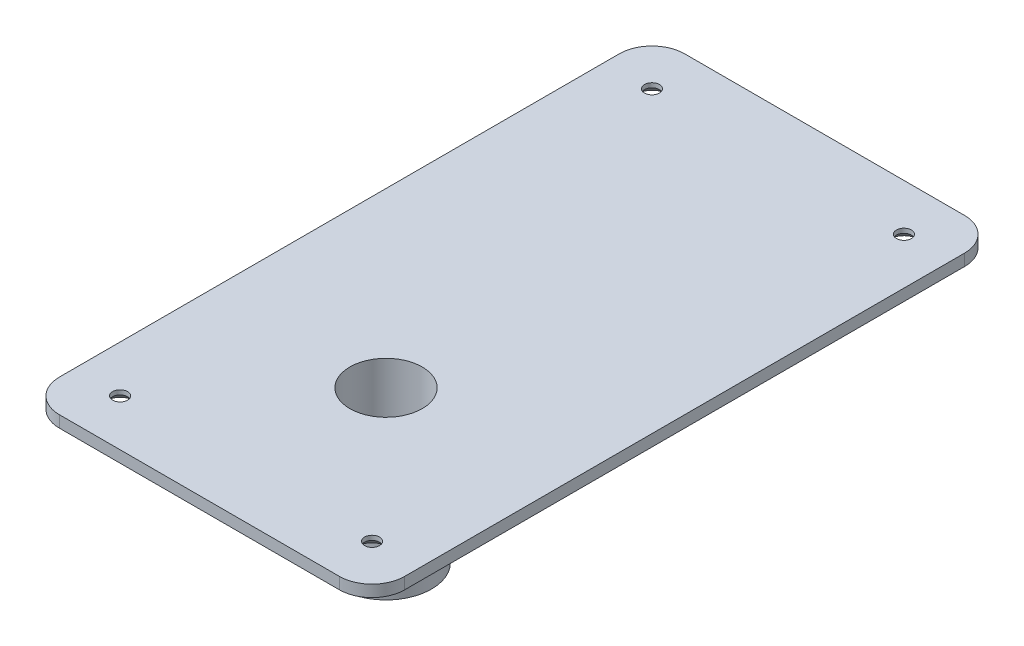
from build123d import *

# Parameters (mm, degrees)
BOSS_EXTRUDE1_DEPTH                                 = 2.5
SKETCH1_4_R                                         = 9.75
SKETCH1_4_R_2                                       = 7.75
BOSS_EXTRUDE3_DEPTH                                 = 30
CUT_EXTRUDE1_START                                  = 10
SKETCH1_5_R                                         = 7.75
CUT_EXTRUDE1_DEPTH                                  = 10
CSK_FOR_M3_COUNTERSUNK_FLAT_HEAD_SCREW1_D           = 3.2
CSK_FOR_M3_COUNTERSUNK_FLAT_HEAD_SCREW1_DEPTH       = 2.5
CSK_FOR_M3_COUNTERSUNK_FLAT_HEAD_SCREW1_CSINK_D     = 6.3
CSK_FOR_M3_COUNTERSUNK_FLAT_HEAD_SCREW1_CSINK_ANGLE = 90
CSK_FOR_M3_COUNTERSUNK_FLAT_HEAD_SCREW1_TIP         = 0.96137699


with BuildPart() as part:
    # Sketch1 → Boss-Extrude1 (new body)
    with BuildSketch(Plane(origin=(0, 0, 0), x_dir=(1, 0, 0), z_dir=(0, 1, 0))):
        with BuildLine():
            Line((-37, 60), (-37, -60))
            ThreePointArc((-37, -60), (-34.949747468, -64.949747468), (-30, -67))
            Line((-30, -67), (30, -67))
            ThreePointArc((30, -67), (34.949747468, -64.949747468), (37, -60))
            Line((37, -60), (37, 60))
            ThreePointArc((37, 60), (34.949747468, 64.949747468), (30, 67))
            Line((30, 67), (-30, 67))
            ThreePointArc((-30, 67), (-34.949747468, 64.949747468), (-37, 60))
        make_face()
    extrude(amount=BOSS_EXTRUDE1_DEPTH)

    # Sketch1<4> → Boss-Extrude3 (add)
    with BuildSketch(Plane(origin=(0, 0, 0), x_dir=(1, 0, 0), z_dir=(0, 1, 0))):
        with Locations((0, -27)):
            Circle(SKETCH1_4_R)
        with Locations((0, -27)):
            Circle(SKETCH1_4_R_2, mode=Mode.SUBTRACT)
    extrude(amount=-BOSS_EXTRUDE3_DEPTH)

    # Sketch1<5> → Cut-Extrude1 (cut)
    with BuildSketch(Plane(origin=(0, 0, 0), x_dir=(1, 0, 0), z_dir=(0, 1, 0)).offset(CUT_EXTRUDE1_START)):
        with Locations((0, -27)):
            Circle(SKETCH1_5_R)
    extrude(amount=-CUT_EXTRUDE1_DEPTH, mode=Mode.SUBTRACT)

    # CSK for M3 Countersunk Flat Head Screw1
    with Locations(Plane(origin=(0, 0, 0), x_dir=(-1, 0, 0), z_dir=(0, -1, 0))):
        with Locations((27, -57), (-27, -57), (-27, 57), (27, 57)):
            CounterSinkHole(CSK_FOR_M3_COUNTERSUNK_FLAT_HEAD_SCREW1_D / 2, CSK_FOR_M3_COUNTERSUNK_FLAT_HEAD_SCREW1_CSINK_D / 2, depth=CSK_FOR_M3_COUNTERSUNK_FLAT_HEAD_SCREW1_DEPTH, counter_sink_angle=CSK_FOR_M3_COUNTERSUNK_FLAT_HEAD_SCREW1_CSINK_ANGLE)
            with Locations((0, 0, -(CSK_FOR_M3_COUNTERSUNK_FLAT_HEAD_SCREW1_DEPTH + CSK_FOR_M3_COUNTERSUNK_FLAT_HEAD_SCREW1_TIP / 2))):  # 118° drill point
                Cone(0, CSK_FOR_M3_COUNTERSUNK_FLAT_HEAD_SCREW1_D / 2, CSK_FOR_M3_COUNTERSUNK_FLAT_HEAD_SCREW1_TIP, mode=Mode.SUBTRACT)


solid = part.part
